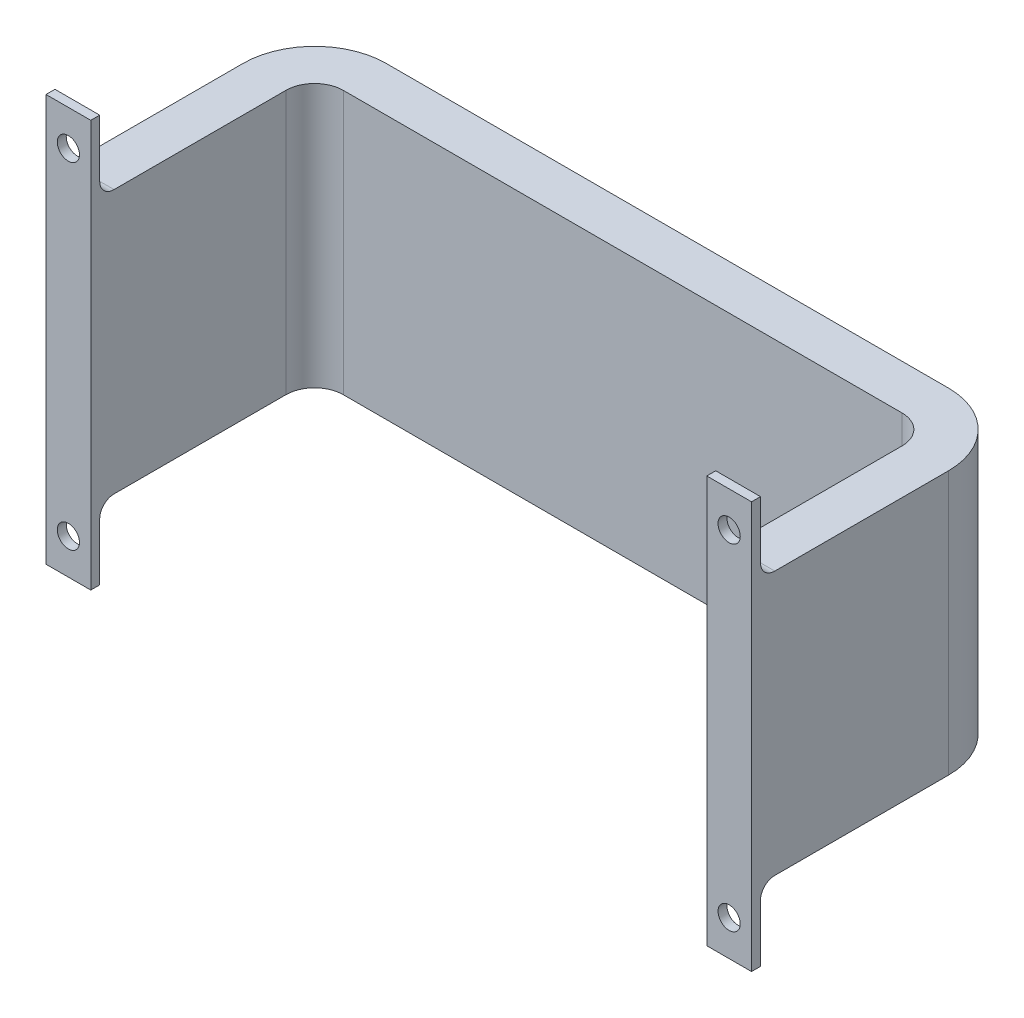
from build123d import *

# Parameters (mm, degrees)
SKETCH1_W           = 250.19
SKETCH1_H           = 93.472
BOSS_EXTRUDE1_DEPTH = 95.25
SKETCH5_W           = 218.44
SKETCH5_H           = 93.472
CUT_EXTRUDE1_DEPTH  = 79.375
SKETCH6_W           = 15.875
SKETCH6_H           = 25.4
BOSS_EXTRUDE2_DEPTH = 3.175
SKETCH7_R           = 3.937
CUT_EXTRUDE2_DEPTH  = 172.26052419
FILLET1_R           = 25.4
FILLET2_R           = 25.4
FILLET3_R           = 5.08
FILLET4_R           = 5.08
FILLET5_R           = 5.08
FILLET6_R           = 5.08
FILLET7_R           = 10.16
FILLET8_R           = 10.16


with BuildPart() as part:
    # Sketch1 → Boss-Extrude1 (new body)
    with BuildSketch(Plane.XY):
        Rectangle(SKETCH1_W, SKETCH1_H)
    extrude(amount=BOSS_EXTRUDE1_DEPTH)

    # Sketch5 → Cut-Extrude1 (cut)
    with BuildSketch(Plane.XY.offset(95.25)):
        Rectangle(SKETCH5_W, SKETCH5_H)
    extrude(amount=-CUT_EXTRUDE1_DEPTH, mode=Mode.SUBTRACT)

    # Sketch6 → Boss-Extrude2 (add)
    with BuildSketch(Plane.XY.offset(95.25)):
        with Locations((117.1575, 59.436)):
            Rectangle(SKETCH6_W, SKETCH6_H)
        with Locations((-117.1575, 59.436)):
            Rectangle(SKETCH6_W, SKETCH6_H)
        with Locations((117.1575, -59.436)):
            Rectangle(SKETCH6_W, SKETCH6_H)
        with Locations((-117.1575, -59.436)):
            Rectangle(SKETCH6_W, SKETCH6_H)
    extrude(amount=-BOSS_EXTRUDE2_DEPTH)

    # Sketch7 → Cut-Extrude2 (cut, through all)
    with BuildSketch(Plane(origin=(0, 0, 92.075), x_dir=(-1, 0, 0), z_dir=(0, 0, -1))):
        with Locations((117.1575, 59.5376)):
            Circle(SKETCH7_R)
        with Locations(Location((-117.1575, 59.5376, 0), (0, 0, 180))):
            Circle(SKETCH7_R)
        with Locations(Location((117.1575, -59.5376, 0), (0, 0, 180))):
            Circle(SKETCH7_R)
        with Locations((-117.1575, -59.5376)):
            Circle(SKETCH7_R)
    extrude(amount=-CUT_EXTRUDE2_DEPTH, mode=Mode.SUBTRACT)

    # Fillet1
    fillet1_edges = [part.edges().sort_by_distance(p)[0] for p in [
        (125.095, 0, 0),
    ]]
    fillet(fillet1_edges, radius=FILLET1_R)

    # Fillet2
    fillet2_edges = [part.edges().sort_by_distance(p)[0] for p in [
        (-125.095, 0, 0),
    ]]
    fillet(fillet2_edges, radius=FILLET2_R)

    # Fillet3
    fillet3_edges = [part.edges().sort_by_distance(p)[0] for p in [
        (117.1575, 46.736, 92.075),
    ]]
    fillet(fillet3_edges, radius=FILLET3_R)

    # Fillet4
    fillet4_edges = [part.edges().sort_by_distance(p)[0] for p in [
        (-117.1575, 46.736, 92.075),
    ]]
    fillet(fillet4_edges, radius=FILLET4_R)

    # Fillet5
    fillet5_edges = [part.edges().sort_by_distance(p)[0] for p in [
        (-117.1575, -46.736, 92.075),
    ]]
    fillet(fillet5_edges, radius=FILLET5_R)

    # Fillet6
    fillet6_edges = [part.edges().sort_by_distance(p)[0] for p in [
        (117.1575, -46.736, 92.075),
    ]]
    fillet(fillet6_edges, radius=FILLET6_R)

    # Fillet7
    fillet7_edges = [part.edges().sort_by_distance(p)[0] for p in [
        (-109.22, 0, 15.875),
    ]]
    fillet(fillet7_edges, radius=FILLET7_R)

    # Fillet8
    fillet8_edges = [part.edges().sort_by_distance(p)[0] for p in [
        (109.22, 0, 15.875),
    ]]
    fillet(fillet8_edges, radius=FILLET8_R)


solid = part.part
